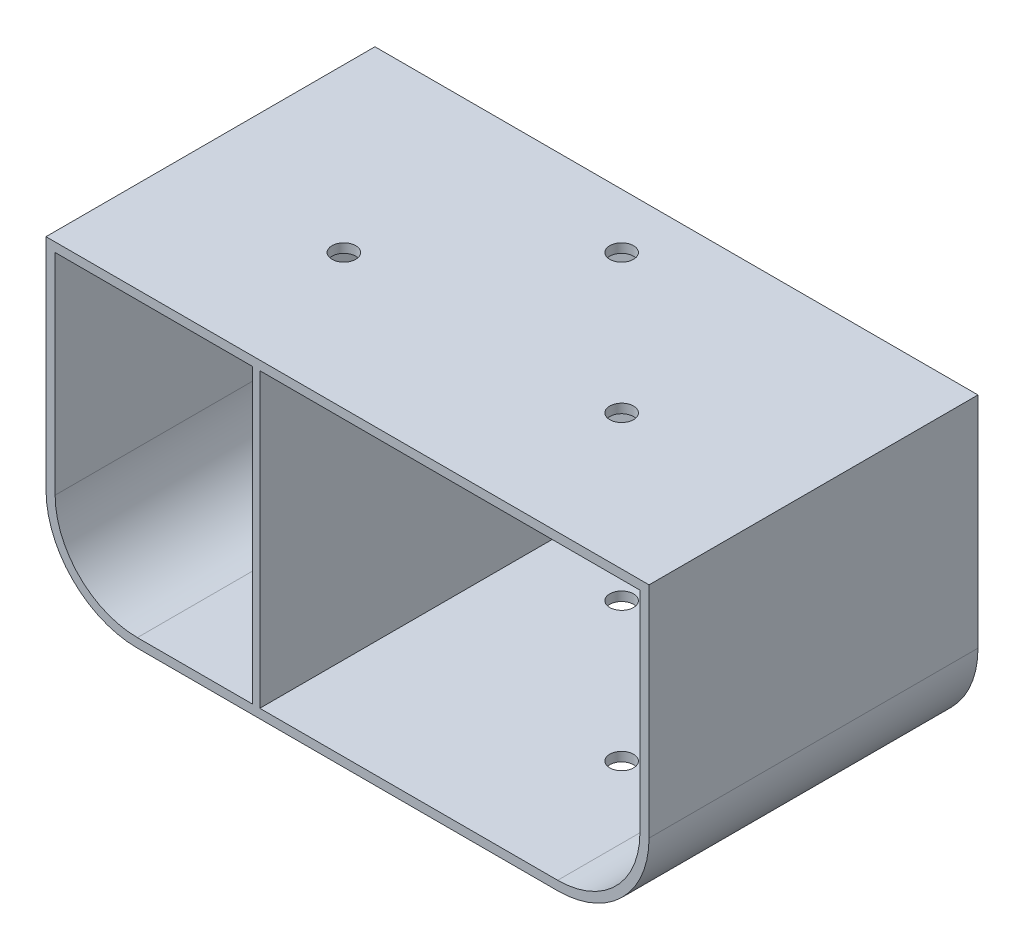
from build123d import *

# Parameters (mm, degrees)
P_IDAT_VYSUNUT_M1_DEPTH       = 90
ODEBRAT_VYSUNUT_M1_DEPTH      = 87
D_RY_PRO_KOL_K_VELIKOST_MM1_D = 6.5


with BuildPart() as part:
    # Skica1 → Přidat vysunutím1 (new body)
    with BuildSketch(Plane.XY):
        with BuildLine():
            Line((-82.5, 42.5), (82.5, 42.5))
            Line((82.5, 42.5), (82.5, -17.5))
            ThreePointArc((82.5, -17.5), (75.17766953, -35.17766953), (57.5, -42.5))
            Line((57.5, -42.5), (-57.5, -42.5))
            ThreePointArc((-57.5, -42.5), (-75.17766953, -35.17766953), (-82.5, -17.5))
            Line((-82.5, -17.5), (-82.5, 42.5))
        make_face()
    extrude(amount=P_IDAT_VYSUNUT_M1_DEPTH)

    # Skica2 → Odebrat vysunutím1 (cut)
    with BuildSketch(Plane.XY.offset(90)):
        with BuildLine():
            Line((80, -17.5), (80, 40))
            Line((80, 40), (-24, 40))
            Line((-24, 40), (-24, -40))
            Line((-24, -40), (57.5, -40))
            ThreePointArc((57.5, -40), (73.409902577, -33.409902577), (80, -17.5))
        make_face()
        with BuildLine():
            Line((-26, -40), (-26, 40))
            Line((-26, 40), (-80, 40))
            Line((-80, 40), (-80, -17.5))
            ThreePointArc((-80, -17.5), (-73.409902577, -33.409902577), (-57.5, -40))
            Line((-57.5, -40), (-26, -40))
        make_face()
    extrude(amount=-ODEBRAT_VYSUNUT_M1_DEPTH, mode=Mode.SUBTRACT)

    # Díry pro kolík, velikost mm1 (through all)
    with Locations(Plane(origin=(0, 42.5, 0), x_dir=(1, 0, 0), z_dir=(0, 1, 0))):
        with Locations((0, -15), (38, -53), (-38, -53)):
            Hole(D_RY_PRO_KOL_K_VELIKOST_MM1_D / 2)


solid = part.part
